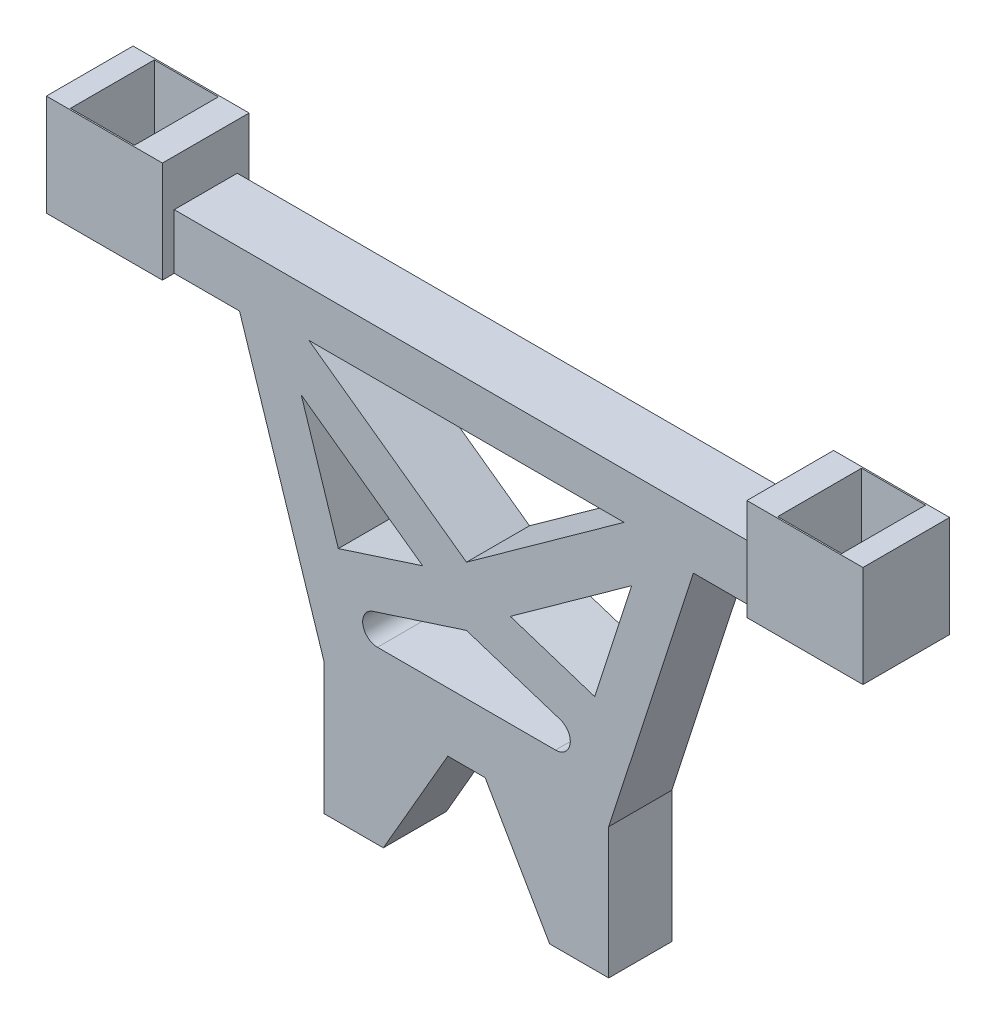
from build123d import *

# Parameters (mm, degrees)
BOSS_EXTRUDE1_DEPTH = 5.588
CUT_EXTRUDE1_REACH  = 80.367
SKETCH2_W           = 75.3618
SKETCH2_H           = 1.524
SKETCH3_W           = 8.255
SKETCH3_H           = 10.8204
CUT_EXTRUDE2_DEPTH  = 83.86461998


with BuildPart() as part:
    # Sketch1 → Boss-Extrude1 (new, symmetric)
    with BuildSketch(Plane.XY):
        Polygon((37.6809, 28.1432), (-37.6809, 28.1432), (-37.6809, 34.109215507), (-52.6415, 34.109215507), (-52.6415, 21.028215507), (-29.263085056, 21.028215507), (-18.341239915, -12.742623419), (-18.341239915, -29.6418), (-10.721239915, -29.6418), (-2.406356809, -15.24), (2.406356809, -15.24), (10.721239915, -29.6418), (18.341239915, -29.6418), (18.341239915, -12.742623419), (29.263085056, 21.028215507), (52.6415, 21.028215507), (52.6415, 34.109215507), (37.6809, 34.109215507), align=None)
        with BuildLine():
            Line((11.480303153, -7.62), (-11.480303153, -7.62))
            ThreePointArc((-11.480303153, -7.62), (-13.362052491, -6.011722817), (-12.066505741, -3.902435097))
            Line((-12.066505741, -3.902435097), (0, 0))
            Line((0, 0), (12.066505741, -3.902435097))
            ThreePointArc((12.066505741, -3.902435097), (13.362052491, -6.011722817), (11.480303153, -7.62))
        make_face(mode=Mode.SUBTRACT)
        Polygon((20.32, 22.225), (-20.32, 22.225), (0, 7.62), align=None, mode=Mode.SUBTRACT)
        Polygon((-21.301071122, 15.641859193), (-5.650084624, 4.392712647), (-16.52547404, 0.87549712), align=None, mode=Mode.SUBTRACT)
        Polygon((16.52547404, 0.87549712), (21.301071122, 15.641859193), (5.650084624, 4.392712647), align=None, mode=Mode.SUBTRACT)
    extrude(amount=BOSS_EXTRUDE1_DEPTH, both=True)

    # Cut-Extrude1: up to this face of the body (flat: up to its plane)
    cut_extrude1_end = Plane(part.part.faces().sort_by_distance((-14.531239915, -29.6418, 0))[0])
    # Sketch2 → Cut-Extrude1 (cut, up to the picked face)
    with BuildSketch(Plane(origin=(0, 28.1432, 0), x_dir=(1, 0, 0), z_dir=(0, 1, 0)), mode=Mode.PRIVATE) as cut_extrude1_sk1:
        with Locations((0, -4.826)):
            Rectangle(SKETCH2_W, SKETCH2_H)
    cut_extrude1_tool1 = split(extrude(cut_extrude1_sk1.sketch, amount=-CUT_EXTRUDE1_REACH, mode=Mode.PRIVATE), bisect_by=cut_extrude1_end, keep=Keep.BOTH, mode=Mode.PRIVATE)
    # Sketch2 → Cut-Extrude1 (cut, up to the picked face)
    with BuildSketch(Plane(origin=(0, 28.1432, 0), x_dir=(1, 0, 0), z_dir=(0, 1, 0)), mode=Mode.PRIVATE) as cut_extrude1_sk2:
        with Locations((0, 4.826)):
            Rectangle(SKETCH2_W, SKETCH2_H)
    cut_extrude1_tool2 = split(extrude(cut_extrude1_sk2.sketch, amount=-CUT_EXTRUDE1_REACH, mode=Mode.PRIVATE), bisect_by=cut_extrude1_end, keep=Keep.BOTH, mode=Mode.PRIVATE)
    add(cut_extrude1_tool1.solids().sort_by(Axis((0, 28.1432, 4.826), (0, -1, 0)))[0], mode=Mode.SUBTRACT)
    add(cut_extrude1_tool2.solids().sort_by(Axis((0, 28.1432, -4.826), (0, -1, 0)))[0], mode=Mode.SUBTRACT)

    # Sketch3 → Cut-Extrude2 (cut, through all)
    with BuildSketch(Plane(origin=(0, 34.109215507, 0), x_dir=(1, 0, 0), z_dir=(0, 1, 0))):
        with Locations((-45.593, 0)):
            Rectangle(SKETCH3_W, SKETCH3_H)
        with Locations((45.593, 0)):
            Rectangle(SKETCH3_W, SKETCH3_H)
    extrude(amount=-CUT_EXTRUDE2_DEPTH, mode=Mode.SUBTRACT)


solid = part.part
